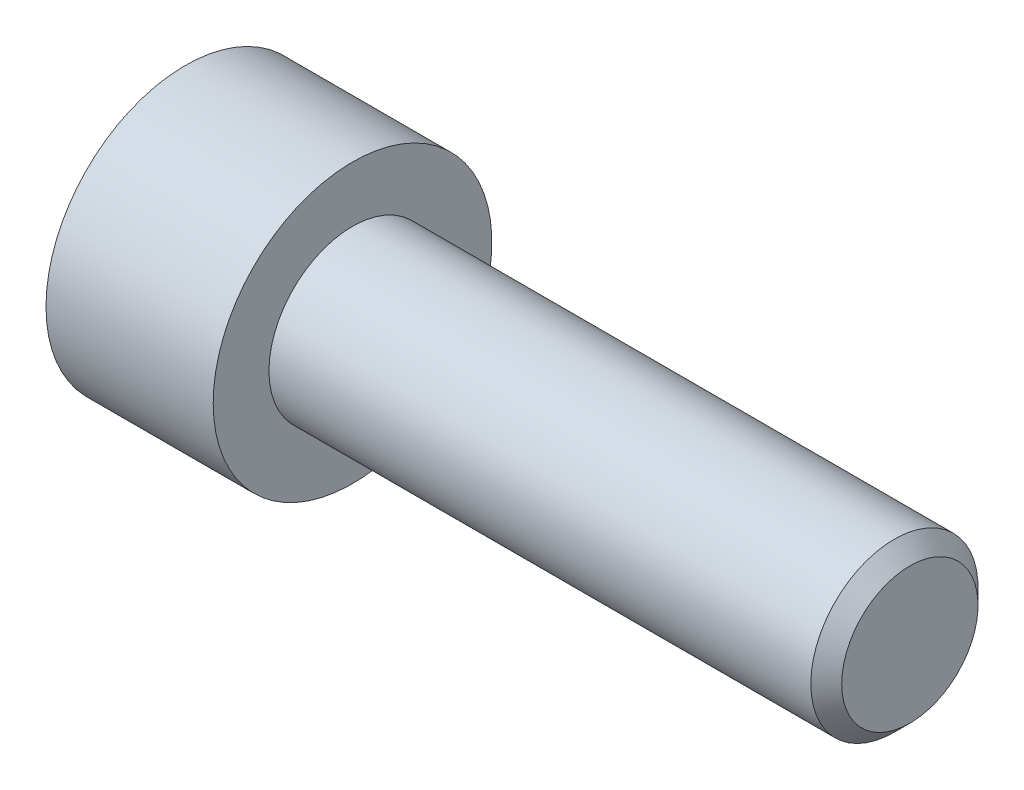
from build123d import *

# Parameters (mm, degrees)
HEXDRIVE_DEPTH = 3


with BuildPart() as part:
    # BodySketch → Base-Revolve (revolve)
    with BuildSketch(Plane(origin=(0, 0, 0), x_dir=(1, 0, 0), z_dir=(0, 1, 0)), mode=Mode.PRIVATE) as base_revolve_sk:
        Polygon((-6, 0), (-6, 5), (0, 5), (0, 3), (19.4455, 3), (20, 2.4455), (20, 0), align=None)
    revolve(base_revolve_sk.sketch.rotate(Axis((-6, 0, 0), (1, 0, 0)), 180), axis=Axis((-6, 0, 0), (1, 0, 0)))

    # DriveSketch → HexDrive (cut)
    with BuildSketch(Plane.ZY.offset(6)):
        Polygon((2.898298351, 0), (1.449149176, 2.51), (-1.449149176, 2.51), (-2.898298351, 0), (-1.449149176, -2.51), (1.449149176, -2.51), align=None)
    extrude(amount=-HEXDRIVE_DEPTH, mode=Mode.SUBTRACT)


solid = part.part
